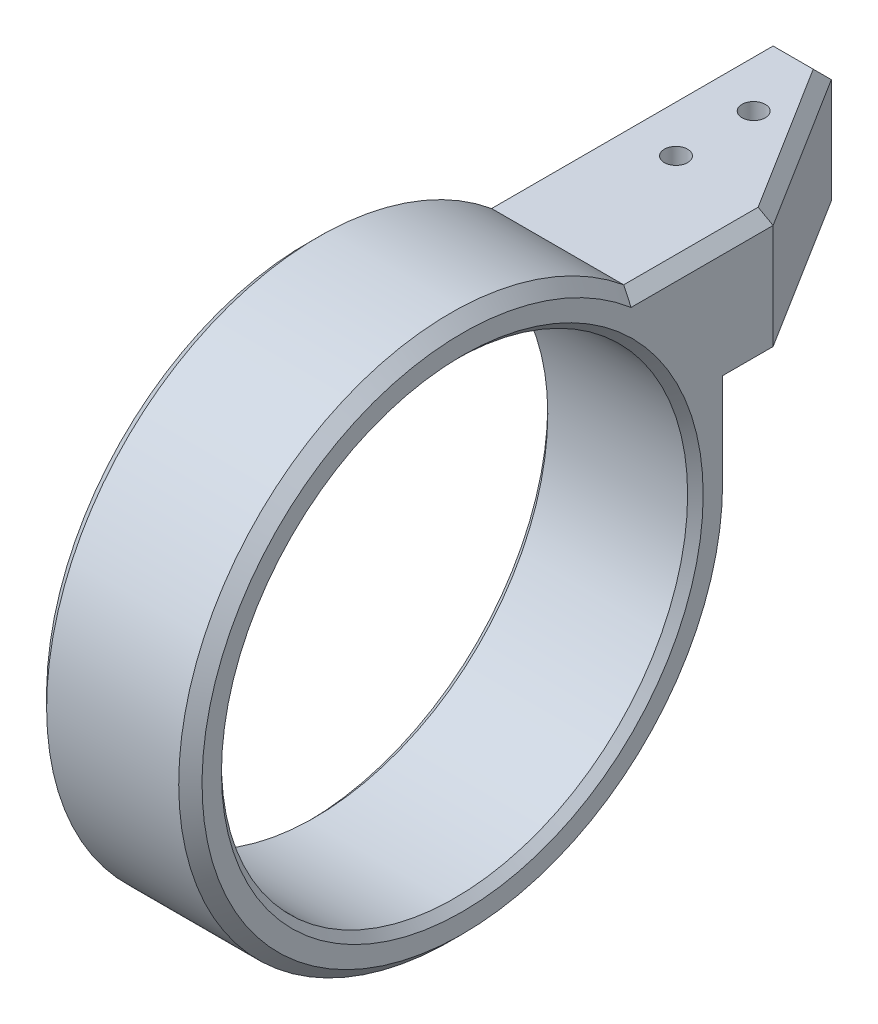
from build123d import *

# Parameters (mm, degrees)
SKETCH_1_R          = 35
EXTRUDE_1_DEPTH     = 20
SKETCH_2_R          = 30
CUT_EXTRUDE_1_DEPTH = 54.38539126
SKETCH_3_W          = 20
SKETCH_3_H          = 15
EXTRUDE_2_DEPTH     = 25
EXTRUDE_3_REACH     = 82.777
SKETCH_4_W          = 20
SKETCH_4_H          = 12
SKETCH_5_R          = 30
CUT_EXTRUDE_2_DEPTH = 73.284161474
CUT_EXTRUDE_3_REACH = 90.566
SKETCH_8_R          = 1.5
CUT_EXTRUDE_4_DEPTH = 79.797208072
CHAMFER_1_SIZE      = 1
CHAMFER_2_SIZE      = 1.5


with BuildPart() as part:
    # 草图1 → 凸台-拉伸1 (new body)
    with BuildSketch(Plane(origin=(0, 0, 0), x_dir=(0, 0, -1), z_dir=(1, 0, 0))):
        Circle(SKETCH_1_R)
    extrude(amount=EXTRUDE_1_DEPTH)

    # 草图2 → 切除-拉伸1 (cut, through all)
    with BuildSketch(Plane(origin=(20, 0, 0), x_dir=(0, 0, -1), z_dir=(1, 0, 0))):
        Circle(SKETCH_2_R)
    extrude(amount=-CUT_EXTRUDE_1_DEPTH, mode=Mode.SUBTRACT)

    # 草图3 → 凸台-拉伸2 (add, symmetric)
    with BuildSketch(Plane(origin=(0, 0, -35), x_dir=(-1, 0, 0), z_dir=(0, 0, -1))):
        with Locations((-10, 19.5)):
            Rectangle(SKETCH_3_W, SKETCH_3_H)
    extrude(amount=EXTRUDE_2_DEPTH, both=True)

    # 草图4 → 凸台-拉伸3 (add, up to next)
    with BuildSketch(Plane(origin=(0, 0, -35), x_dir=(-1, 0, 0), z_dir=(0, 0, -1)), mode=Mode.PRIVATE) as extrude_3_sk1:
        with Locations((-10, 6)):
            Rectangle(SKETCH_4_W, SKETCH_4_H)
    extrude_3_tool1 = extrude(extrude_3_sk1.sketch, amount=-EXTRUDE_3_REACH, mode=Mode.PRIVATE) - part.part
    add(extrude_3_tool1.solids().sort_by_distance((10, 6, -35))[0])

    # 草图5 → 切除-拉伸2 (cut, through all)
    with BuildSketch(Plane(origin=(20, 0, 0), x_dir=(0, 0, -1), z_dir=(1, 0, 0))):
        Circle(SKETCH_5_R)
    extrude(amount=-CUT_EXTRUDE_2_DEPTH, mode=Mode.SUBTRACT)

    # 草图6 → 切除-拉伸3 (cut, up to next)
    with BuildSketch(Plane(origin=(0, 27, 0), x_dir=(1, 0, 0), z_dir=(0, 1, 0)), mode=Mode.PRIVATE) as cut_extrude_3_sk1:
        Polygon((7.5, 60), (20, 40), (20, 60), align=None)
    cut_extrude_3_tool1 = extrude(cut_extrude_3_sk1.sketch, amount=-CUT_EXTRUDE_3_REACH, mode=Mode.PRIVATE) & part.part
    add(cut_extrude_3_tool1.solids().sort_by_distance((15.833333, 27, -53.333333))[0], mode=Mode.SUBTRACT)

    # 草图8 → 切除-拉伸4 (cut, through all)
    with BuildSketch(Plane(origin=(0, 12, 0), x_dir=(-1, 0, 0), z_dir=(0, -1, 0))):
        with Locations(Location((-7.5, 40, 0), (0, 0, 180))):
            Circle(SKETCH_8_R)
        with Locations(Location((-7.5, 50, 0), (0, 0, 180))):
            Circle(SKETCH_8_R)
    extrude(amount=-CUT_EXTRUDE_4_DEPTH, mode=Mode.SUBTRACT)

    # 倒角1
    chamfer_1_edges = [part.edges().sort_by_distance(p)[0] for p in [
        (0, -12, 27.49545417),
        (20, -12, 27.49545417),
    ]]
    chamfer(chamfer_1_edges, length=CHAMFER_1_SIZE)

    # 倒角2
    chamfer_2_edges = [part.edges().sort_by_distance(p)[0] for p in [
        (0, -14.925029132, 31.658229663),
        (20, -14.925029132, 31.658229663),
        (0, 27, -41.135528726),
        (3.75, 27, -60),
        (20, 6, -35),
        (0, 6, -35),
        (20, 27, -31.135528726),
        (13.75, 27, -50),
    ]]
    chamfer(chamfer_2_edges, length=CHAMFER_2_SIZE)


solid = part.part
